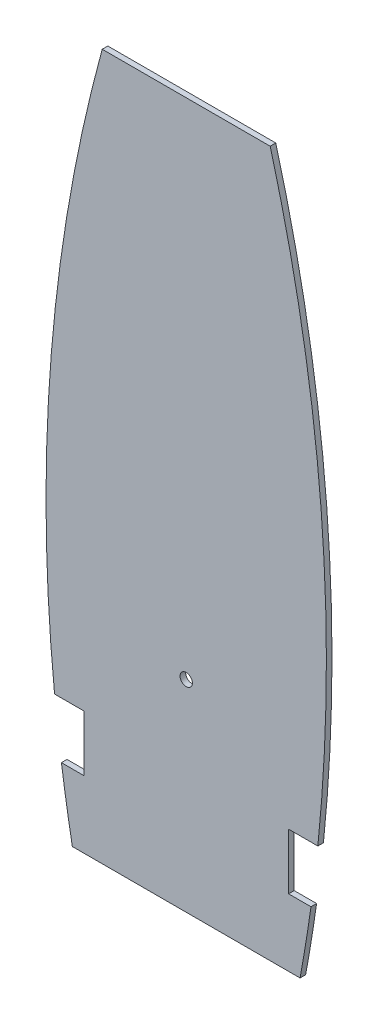
from build123d import *

# Parameters (mm, degrees)
BOSS_EXTRUDE1_DEPTH = 5
SKETCH3_R           = 5.5
CUT_EXTRUDE1_DEPTH  = 1008.818415992
SKETCH4_W           = 203.352119636
SKETCH4_H           = 409.958390473
CUT_EXTRUDE2_DEPTH  = 1008.818415992


with BuildPart() as part:
    # Sketch2 → Boss-Extrude1 (new body)
    with BuildSketch(Plane.XY):
        with BuildLine():
            Line((-75, 0), (75, 0))
            ThreePointArc((75, 0), (125.183748831, -378.01295639), (72.466338168, -755.680903745))
            Line((72.466338168, -755.680903745), (4.813443083, -996.353057902))
            ThreePointArc((4.813443083, -996.353057902), (3.01949586, -998.985303596), (0, -1000))
            ThreePointArc((0, -1000), (-3.01949586, -998.985303596), (-4.813443083, -996.353057902))
            Line((-4.813443083, -996.353057902), (-72.466338168, -755.680903745))
            ThreePointArc((-72.466338168, -755.680903745), (-125.183748831, -378.01295639), (-75, 0))
        make_face()
    extrude(amount=BOSS_EXTRUDE1_DEPTH)

    # Sketch3 → Cut-Extrude1 (cut, through all)
    with BuildSketch(Plane(origin=(0, 0, 0), x_dir=(-1, 0, 0), z_dir=(0, 0, -1))):
        with Locations((0, -450)):
            Circle(SKETCH3_R)
    extrude(amount=-CUT_EXTRUDE1_DEPTH, mode=Mode.SUBTRACT)

    # Sketch4 → Cut-Extrude2 (cut, through all)
    with BuildSketch(Plane(origin=(0, 0, 0), x_dir=(-1, 0, 0), z_dir=(0, 0, -1))):
        with BuildLine():
            Line((-117.553772729, -520), (-91.431313106, -520))
            Line((-91.431313106, -520), (-91.431313106, -570))
            Line((-91.431313106, -570), (-111.431313106, -570))
            ThreePointArc((-111.431313106, -570), (-125.443374502, -546.340920484), (-117.553772729, -520))
        make_face()
        with BuildLine():
            Line((117.553772729, -520), (91.431313106, -520))
            Line((91.431313106, -520), (91.431313106, -570))
            Line((91.431313106, -570), (111.431313106, -570))
            ThreePointArc((111.431313106, -570), (125.443374502, -546.340920484), (117.553772729, -520))
        make_face()
        with Locations((0, -834.979195237)):
            Rectangle(SKETCH4_W, SKETCH4_H)
    extrude(amount=-CUT_EXTRUDE2_DEPTH, mode=Mode.SUBTRACT)


solid = part.part
